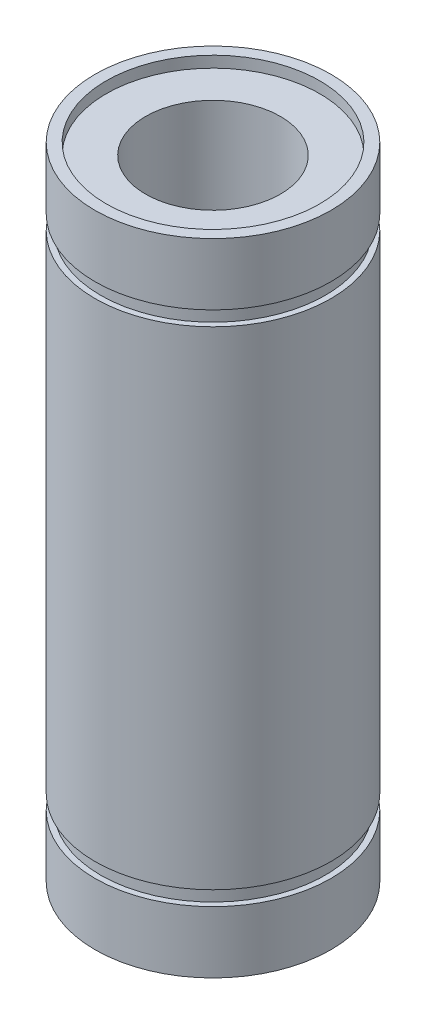
from build123d import *

# Parameters (mm, degrees)
SKETCH1_R         = 10.5
SKETCH1_R_2       = 6
EXTRUDE1_DEPTH    = 57
SKETCH2_R         = 9.5
EXTRUDE2_DEPTH    = 1
EXTRUDE3_START    = -1
SKETCH3_R         = 9.5
EXTRUDE3_DEPTH    = 1
SKETCH4_OUTSIDE_W = 35.854
SKETCH4_OUTSIDE_H = 35.854
SKETCH4_OUTSIDE_R = 10
EXTRUDE4_DEPTH    = 1.3
SKETCH5_OUTSIDE_W = 35.854
SKETCH5_OUTSIDE_H = 35.854
SKETCH5_OUTSIDE_R = 10
EXTRUDE5_DEPTH    = 1.3


with BuildPart() as part:
    # Sketch1 → Extrude1 (new body)
    with BuildSketch(Plane(origin=(0, 0, 0), x_dir=(1, 0, 0), z_dir=(0, 1, 0))):
        with Locations(Location((0, 0, 0), (0, 0, 90))):
            Circle(SKETCH1_R)
        with Locations(Location((0, 0, 0), (0, 0, 90))):
            Circle(SKETCH1_R_2, mode=Mode.SUBTRACT)
    extrude(amount=EXTRUDE1_DEPTH)

    # Sketch2 → Extrude2 (cut)
    with BuildSketch(Plane(origin=(0, 57, 0), x_dir=(1, 0, 0), z_dir=(0, 1, 0))):
        with Locations(Location((0, 0, 0), (0, 0, 270))):
            Circle(SKETCH2_R)
    extrude(amount=-EXTRUDE2_DEPTH, mode=Mode.SUBTRACT)

    # Sketch3 → Extrude3 (cut)
    with BuildSketch(Plane.XZ.offset(EXTRUDE3_START)):
        with Locations(Location((0, 0, 0), (0, 0, 90))):
            Circle(SKETCH3_R)
    extrude(amount=EXTRUDE3_DEPTH, mode=Mode.SUBTRACT)

    # Sketch4 outside → Extrude4 (cut)
    with BuildSketch(Plane(origin=(0, 51.5, 0), x_dir=(1, 0, 0), z_dir=(0, 1, 0))):
        Rectangle(SKETCH4_OUTSIDE_W, SKETCH4_OUTSIDE_H)
        with Locations(Location((0, 0, 0), (0, 0, 270))):
            Circle(SKETCH4_OUTSIDE_R, mode=Mode.SUBTRACT)
    extrude(amount=-EXTRUDE4_DEPTH, mode=Mode.SUBTRACT)

    # Sketch5 outside → Extrude5 (cut)
    with BuildSketch(Plane(origin=(0, 5.5, 0), x_dir=(-1, 0, 0), z_dir=(0, -1, 0))):
        Rectangle(SKETCH5_OUTSIDE_W, SKETCH5_OUTSIDE_H)
        with Locations(Location((0, 0, 0), (0, 0, 270))):
            Circle(SKETCH5_OUTSIDE_R, mode=Mode.SUBTRACT)
    extrude(amount=-EXTRUDE5_DEPTH, mode=Mode.SUBTRACT)


solid = part.part
